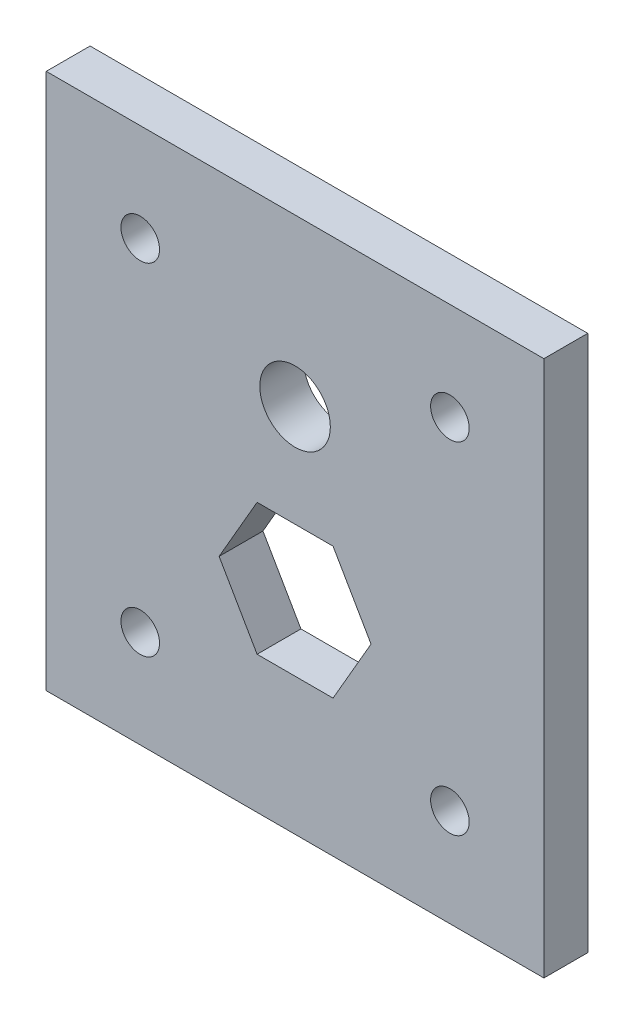
from build123d import *

# Parameters (mm, degrees)
SKETCH1_W           = 36.024962638
SKETCH1_H           = 38.826904176
SKETCH1_R           = 1.397
SKETCH1_R_2         = 2.5527
BOSS_EXTRUDE1_DEPTH = 3.175


with BuildPart() as part:
    # Sketch1 → Boss-Extrude1 (new body)
    with BuildSketch(Plane.XY):
        with Locations((34.711147671, -14.342506761)):
            Rectangle(SKETCH1_W, SKETCH1_H)
        with Locations((45.918913825, -2.000621413)):
            Circle(SKETCH1_R, mode=Mode.SUBTRACT)
        with Locations((23.503381517, -2.000621413)):
            Circle(SKETCH1_R, mode=Mode.SUBTRACT)
        with Locations((23.503381517, -26.684392109)):
            Circle(SKETCH1_R, mode=Mode.SUBTRACT)
        with Locations((45.918913825, -26.684392109)):
            Circle(SKETCH1_R, mode=Mode.SUBTRACT)
        with Locations((34.711147671, -6.937375552)):
            Circle(SKETCH1_R_2, mode=Mode.SUBTRACT)
        Polygon((40.210408985, -19.079122219), (37.460778328, -14.316622219), (31.961517014, -14.316622219), (29.211886357, -19.079122219), (31.961517014, -23.841622219), (37.460778328, -23.841622219), align=None, mode=Mode.SUBTRACT)
    extrude(amount=BOSS_EXTRUDE1_DEPTH)


solid = part.part
